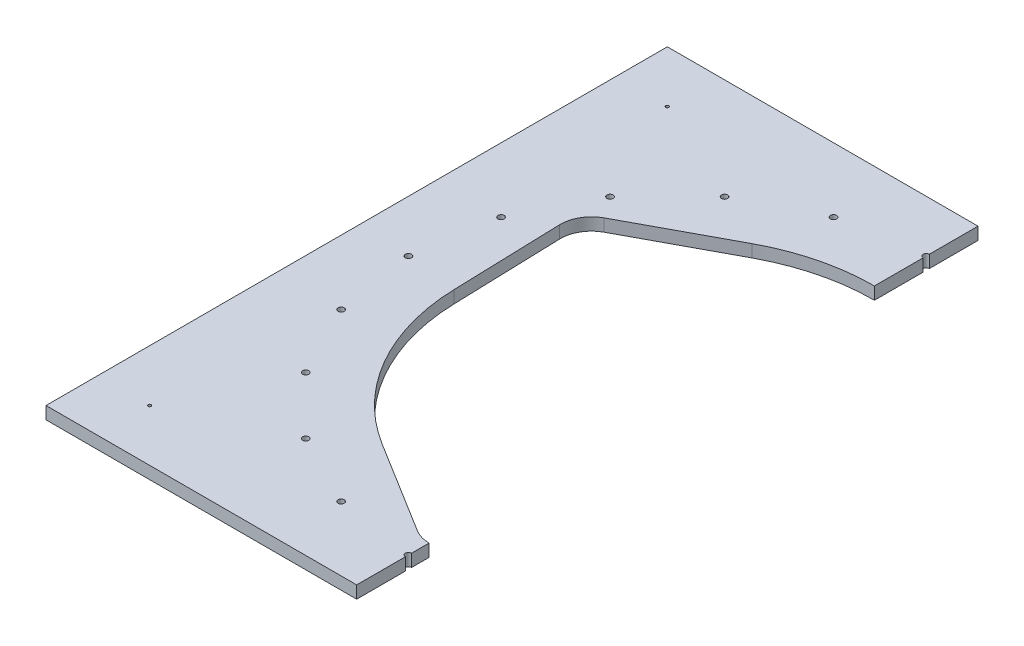
from build123d import *

# Parameters (mm, degrees)
SKETCH1_R           = 3
SKETCH1_R_2         = 1.5
BOSS_EXTRUDE1_DEPTH = 12


with BuildPart() as part:
    # Sketch1 → Boss-Extrude1 (new body)
    with BuildSketch(Plane(origin=(0, 0, 0), x_dir=(1, 0, 0), z_dir=(0, 1, 0))):
        with BuildLine():
            Line((-203.190468868, 99.063784307), (-199.902587408, -6.241437954))
            ThreePointArc((-199.902587408, -6.241437954), (-173.205080757, -100), (-105.356537529, -170))
            Line((-105.356537529, -170), (-15.803480629, -225.5))
            ThreePointArc((-15.803480629, -225.5), (-8.215838363, -228.853076093), (0, -230))
            Line((0, -230), (0, -247))
            ThreePointArc((0, -247), (-3, -250), (0, -253))
            Line((0, -253), (0, -300))
            Line((0, -300), (-300, -300))
            Line((-300, -300), (-300, 300))
            Line((-300, 300), (0, 300))
            Line((0, 300), (0, 253))
            ThreePointArc((0, 253), (-3, 250), (0, 247))
            Line((0, 247), (0, 200))
            ThreePointArc((0, 200), (-48.742755406, 193.969440365), (-94.546049879, 176.241437954))
            Line((-94.546049879, 176.241437954), (-187.386988239, 126.436215693))
            ThreePointArc((-187.386988239, 126.436215693), (-199.18584287, 115), (-203.190468868, 99.063784307))
        make_face()
        with Locations(Location((-77.254248594, -237.764129074, 0), (0, 0, 270))):
            Circle(SKETCH1_R, mode=Mode.SUBTRACT)
        with Locations(Location((-146.946313073, -202.254248594, 0), (0, 0, 270))):
            Circle(SKETCH1_R, mode=Mode.SUBTRACT)
        with Locations(Location((-202.254248594, -146.946313073, 0), (0, 0, 270))):
            Circle(SKETCH1_R, mode=Mode.SUBTRACT)
        with Locations(Location((-237.764129074, -77.254248594, 0), (0, 0, 270))):
            Circle(SKETCH1_R, mode=Mode.SUBTRACT)
        with Locations(Location((-250, 0, 0), (0, 0, 270))):
            Circle(SKETCH1_R, mode=Mode.SUBTRACT)
        with Locations(Location((-237.764129074, 77.254248594, 0), (0, 0, 270))):
            Circle(SKETCH1_R, mode=Mode.SUBTRACT)
        with Locations(Location((-202.254248594, 146.946313073, 0), (0, 0, 270))):
            Circle(SKETCH1_R, mode=Mode.SUBTRACT)
        with Locations(Location((-146.946313073, 202.254248594, 0), (0, 0, 270))):
            Circle(SKETCH1_R, mode=Mode.SUBTRACT)
        with Locations(Location((-77.254248594, 237.764129074, 0), (0, 0, 270))):
            Circle(SKETCH1_R, mode=Mode.SUBTRACT)
        with Locations(Location((-250, 250, 0), (0, 0, 270))):
            Circle(SKETCH1_R_2, mode=Mode.SUBTRACT)
        with Locations(Location((-250, -250, 0), (0, 0, 270))):
            Circle(SKETCH1_R_2, mode=Mode.SUBTRACT)
    extrude(amount=BOSS_EXTRUDE1_DEPTH)


solid = part.part
